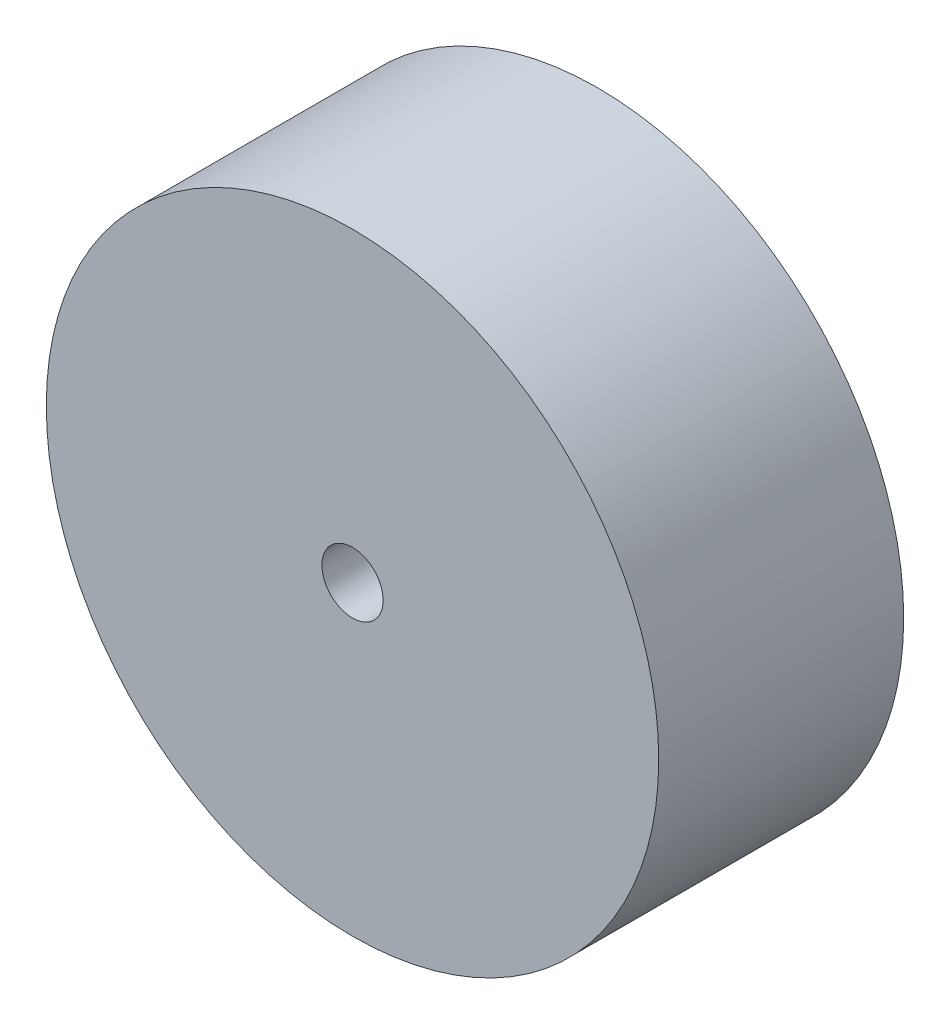
from build123d import *

# Parameters (mm, degrees)
ESQUISSE1_R      = 25
ESQUISSE1_R_2    = 2.5
EXTRUSION1_DEPTH = 20


with BuildPart() as part:
    # Esquisse1 → Extrusion1 (new body)
    with BuildSketch(Plane.XY):
        Circle(ESQUISSE1_R)
        Circle(ESQUISSE1_R_2, mode=Mode.SUBTRACT)
    extrude(amount=EXTRUSION1_DEPTH)


solid = part.part
